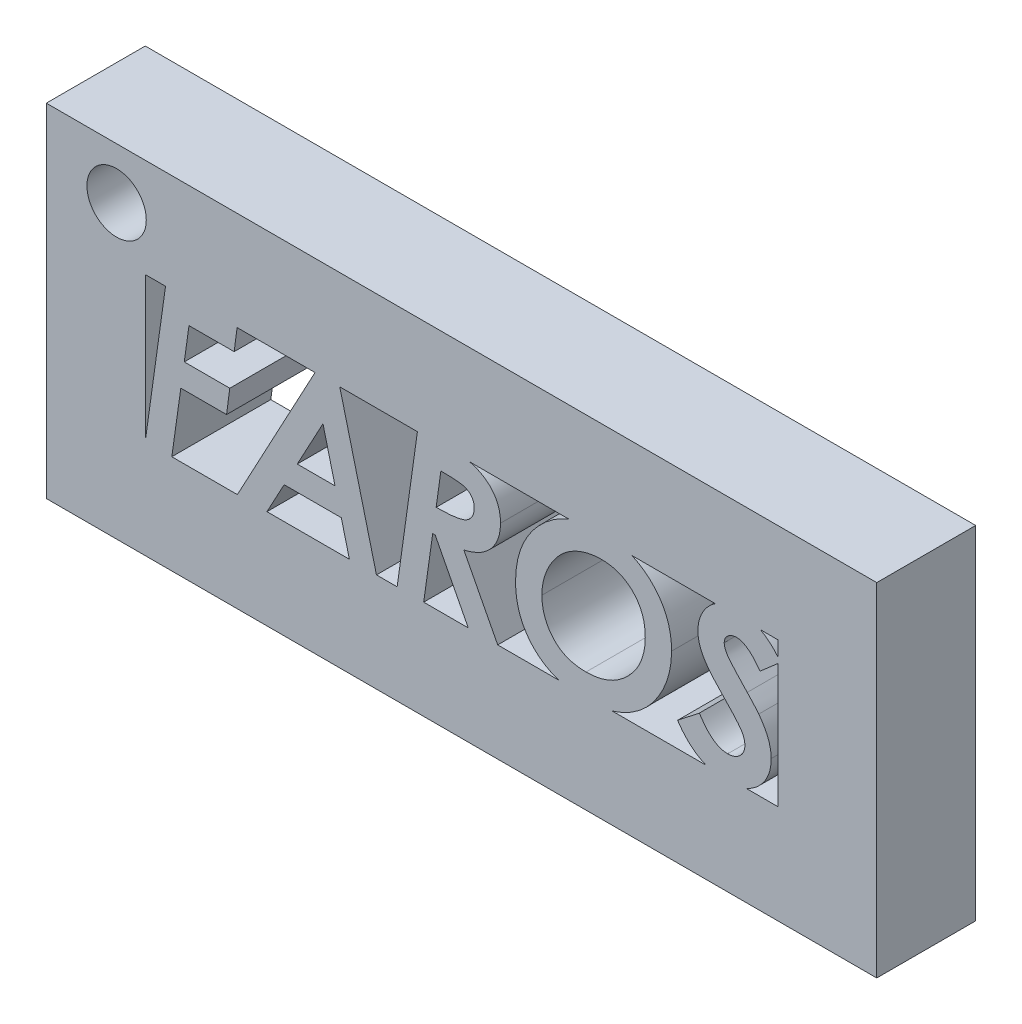
from build123d import *

# Parameters (mm, degrees)
BOSS_EXTRUDE4_DEPTH   = 5
BOSS_EXTRUDE4_2_DEPTH = 5
BOSS_EXTRUDE4_3_DEPTH = 5
BOSS_EXTRUDE4_4_DEPTH = 5
BOSS_EXTRUDE4_5_DEPTH = 5
SKETCH11_W            = 41.961124968
SKETCH11_H            = 17.302820452
SKETCH11_R            = 1.5
SKETCH11_W_2          = 31.961124968
SKETCH11_H_2          = 7.302820452
BOSS_EXTRUDE6_DEPTH   = 5


with BuildPart() as part:
    # Sketch9 → Boss-Extrude4 (new body)
    with BuildSketch(Plane.XY):
        Polygon((-20.86923015, 7.785590237), (-17.254105951, 7.785590237), (-17.415866435, 6.550868015), (-19.698321697, 6.550868015), (-19.937252319, 4.84125263), (-17.636988564, 4.84125263), (-17.800233088, 3.606530408), (-20.110885131, 3.606530408), (-20.566485759, 0.377256904), (-21.908058943, 0.377256904), align=None)
    extrude(amount=BOSS_EXTRUDE4_DEPTH)



with BuildPart() as body_2:
    # Sketch9 → Boss-Extrude4 2 (new body)
    with BuildSketch(Plane.XY):
        Polygon((-13.272423593, 7.785590237), (-12.105967263, 7.785590237), (-10.225687148, 0.377256904), (-11.592489031, 0.377256904), (-12.002084384, 1.991893656), (-14.891512469, 1.991893656), (-15.75819249, 0.377256904), (-17.254105951, 0.377256904), align=None)
        Polygon((-12.318185145, 3.226615878), (-12.92812605, 5.641150801), (-14.228146082, 3.226615878), align=None, mode=Mode.SUBTRACT)
    extrude(amount=BOSS_EXTRUDE4_2_DEPTH)


with BuildPart() as body_3:
    # Sketch9 → Boss-Extrude4 3 (new body)
    with BuildSketch(Plane.XY):
        with BuildLine():
            Line((-8.142093398, 7.785590237), (-6.855429736, 7.785590237))
            add(Edge.make_bspline(
                [(-6.855429736, 7.785590237), (-6.759945383, 7.785200034), (-6.57584007, 7.784447675), (-6.311090643, 7.773749139), (-6.068095708, 7.757608344), (-5.847144198, 7.736307368), (-5.648051641, 7.706753456), (-5.471232062, 7.671268064), (-5.315556075, 7.631750135), (-5.222197735, 7.595027498), (-5.178463256, 7.577824479)],
                knots=[0, 0, 0, 0, 1.348808202, 2.600664361, 3.742342956, 4.788858012, 5.735658768, 6.584006912, 7.336666444, 8, 8, 8, 8], degree=3))
            add(Edge.make_bspline(
                [(-5.178463256, 7.577824479), (-5.129223857, 7.555619862), (-5.032968625, 7.51221335), (-4.895040487, 7.438636648), (-4.765881521, 7.359374573), (-4.647632305, 7.271438682), (-4.537797417, 7.178531675), (-4.437057929, 7.079769881), (-4.346225006, 6.973637614), (-4.264345376, 6.862038495), (-4.191538364, 6.745116863), (-4.129041045, 6.622296145), (-4.075000695, 6.494616172), (-4.032799662, 6.360687563), (-3.99772553, 6.222117981), (-3.975040853, 6.078033146), (-3.959076448, 5.928919081), (-3.957764663, 5.827690121), (-3.957097404, 5.776198544)],
                knots=[0, 0, 0, 0, 1.116361014, 2.182309107, 3.229450697, 4.24598407, 5.225421932, 6.201651319, 7.158895679, 8.110002388, 9.060669178, 10.002827475, 10.956240434, 11.923213192, 12.902917952, 13.908279153, 14.936015885, 16, 16, 16, 16], degree=3))
            add(Edge.make_bspline(
                [(-3.957097404, 5.776198544), (-3.958666629, 5.712834614), (-3.961764532, 5.587743959), (-3.982006883, 5.403280959), (-4.019761382, 5.226269561), (-4.070605307, 5.056152162), (-4.133596846, 4.89182727), (-4.214832678, 4.736154263), (-4.308731198, 4.586420727), (-4.417174405, 4.444589767), (-4.538385799, 4.309360312), (-4.678342491, 4.18869077), (-4.82930188, 4.07446577), (-4.997465589, 3.974343595), (-5.178208702, 3.881339011), (-5.375653713, 3.802539874), (-5.586094888, 3.729820434), (-5.733652403, 3.693425367), (-5.809180738, 3.6747963)],
                knots=[0, 0, 0, 0, 0.995453645, 1.965186658, 2.910129054, 3.83459069, 4.752398018, 5.669942118, 6.588407184, 7.525617038, 8.471772905, 9.435289717, 10.423772802, 11.441988612, 12.505459691, 13.613754905, 14.778583949, 16, 16, 16, 16], degree=3))
            Line((-5.809180738, 3.6747963), (-4.099565353, 0.377256904))
            Line((-4.099565353, 0.377256904), (-5.585090527, 0.377256904))
            Line((-5.585090527, 0.377256904), (-7.259088924, 3.606530408))
            Line((-7.259088924, 3.606530408), (-7.383748379, 3.606530408))
            Line((-7.383748379, 3.606530408), (-7.839349007, 0.377256904))
            Line((-7.839349007, 0.377256904), (-9.180922191, 0.377256904))
            Line((-9.180922191, 0.377256904), (-8.142093398, 7.785590237))
        make_face()
        with BuildLine():
            add(Edge.make_bspline(
                [(-7.210115567, 4.84125263), (-7.114628003, 4.842136593), (-6.931984317, 4.843827392), (-6.671138366, 4.855658687), (-6.436386488, 4.874141036), (-6.227990092, 4.901031325), (-6.045293125, 4.932376752), (-5.888652739, 4.971707461), (-5.75782267, 5.018451382), (-5.650742016, 5.073889149), (-5.563999228, 5.138977614), (-5.488919638, 5.208437395), (-5.426402367, 5.286189883), (-5.374820016, 5.370929829), (-5.335036249, 5.462832861), (-5.306346002, 5.562521613), (-5.290482937, 5.669331399), (-5.28804433, 5.743005114), (-5.286798259, 5.780650667)],
                knots=[0, 0, 0, 0, 1.89335902, 3.621519463, 5.176573087, 6.561132097, 7.786781855, 8.850229336, 9.759505088, 10.53614971, 11.230649399, 11.903761734, 12.55942339, 13.202041648, 13.865362736, 14.539046595, 15.253486819, 16, 16, 16, 16], degree=3))
            add(Edge.make_bspline(
                [(-5.286798259, 5.780650667), (-5.28841125, 5.823335288), (-5.291540231, 5.906137601), (-5.318604635, 6.025396827), (-5.364883846, 6.13358108), (-5.429922931, 6.229656365), (-5.511088351, 6.314369945), (-5.610105181, 6.384144645), (-5.725844551, 6.439057574), (-5.834257392, 6.475382946), (-5.936416233, 6.496207589), (-6.032016628, 6.510775539), (-6.145340755, 6.523969484), (-6.276524863, 6.534176062), (-6.425019241, 6.540900826), (-6.591220632, 6.547331402), (-6.775286157, 6.549642912), (-6.903908744, 6.550447286), (-6.971184944, 6.550868015)],
                knots=[0, 0, 0, 0, 0.975025327, 1.891415476, 2.778007847, 3.650053007, 4.529910843, 5.446300992, 6.402314795, 7.450247022, 8.051382379, 8.78400578, 9.660805258, 10.659230114, 11.791644133, 13.059173022, 14.461796856, 16, 16, 16, 16], degree=3))
            Line((-6.971184944, 6.550868015), (-7.210115567, 4.84125263))
        make_face(mode=Mode.SUBTRACT)
    extrude(amount=BOSS_EXTRUDE4_3_DEPTH)


with BuildPart() as body_4:
    # Sketch9 → Boss-Extrude4 4 (new body)
    with BuildSketch(Plane.XY):
        with BuildLine():
            add(Edge.make_bspline(
                [(1.164328544, 7.975547502), (1.289137423, 7.972928124), (1.534195946, 7.967785052), (1.893399412, 7.920456336), (2.236086693, 7.844172228), (2.561422845, 7.73478263), (2.870657002, 7.596588136), (3.163045058, 7.426281055), (3.438267747, 7.2250634), (3.694084117, 6.995661608), (3.925805048, 6.742902044), (4.131292748, 6.472370429), (4.301948058, 6.182836228), (4.442487382, 5.877523491), (4.553273793, 5.556098385), (4.62884606, 5.217016292), (4.678729756, 4.862523994), (4.683519131, 4.6203061), (4.685958151, 4.496955088)],
                knots=[0, 0, 0, 0, 1.079937363, 2.120424901, 3.130164457, 4.114608815, 5.086352068, 6.057283592, 7.037967613, 8.032612779, 9.026667848, 10.002130715, 10.967845321, 11.92966918, 12.907375778, 13.904589319, 14.932898699, 16, 16, 16, 16], degree=3))
            add(Edge.make_bspline(
                [(4.685958151, 4.496955088), (4.684396117, 4.400915112), (4.681289353, 4.209899044), (4.651727024, 3.925877474), (4.60567291, 3.645886605), (4.542613873, 3.369845626), (4.458203089, 3.098639888), (4.357443621, 2.830662525), (4.237241357, 2.567009941), (4.099195532, 2.309724279), (3.947969492, 2.061836158), (3.782216498, 1.827439557), (3.604147296, 1.607925582), (3.414445297, 1.402430022), (3.211062096, 1.213703927), (2.997972902, 1.037793636), (2.770561515, 0.878697633), (2.53243809, 0.733376538), (2.283104951, 0.604224811), (2.024246901, 0.492597921), (1.756200842, 0.399267644), (1.479599685, 0.322107888), (1.193760237, 0.260722722), (0.898735422, 0.218317852), (0.594421748, 0.192582781), (0.388720491, 0.189078604), (0.284292152, 0.187299639)],
                knots=[0, 0, 0, 0, 1.005311864, 1.999487392, 2.986390894, 3.975195422, 4.961487101, 5.958115224, 6.97104375, 7.992937587, 9.013623077, 10.009524137, 10.996414046, 11.971324635, 12.935123389, 13.899409138, 14.862205298, 15.838449601, 16.81836937, 17.799766407, 18.787539403, 19.787875373, 20.804768927, 21.846385261, 22.906674593, 24, 24, 24, 24], degree=3))
            add(Edge.make_bspline(
                [(0.284292152, 0.187299639), (0.155038898, 0.189963296), (-0.097343069, 0.195164395), (-0.465172518, 0.241100304), (-0.81319342, 0.312822105), (-1.141421816, 0.415497243), (-1.450469163, 0.54789515), (-1.739315597, 0.7103525), (-2.008668367, 0.901098032), (-2.254012121, 1.121483776), (-2.477104622, 1.36322626), (-2.668676222, 1.628335581), (-2.834109593, 1.909654525), (-2.965357387, 2.21179268), (-3.070378896, 2.53104239), (-3.143548889, 2.869240137), (-3.189306382, 3.225853751), (-3.194574035, 3.469855567), (-3.197268345, 3.594658079)],
                knots=[0, 0, 0, 0, 1.129126937, 2.20475128, 3.23403939, 4.230775744, 5.204839333, 6.16680792, 7.121629951, 8.083044708, 9.04383724, 9.990659777, 10.936010704, 11.890255174, 12.863608629, 13.868449271, 14.909750384, 16, 16, 16, 16], degree=3))
            add(Edge.make_bspline(
                [(-3.197268345, 3.594658079), (-3.194031323, 3.737313213), (-3.187657455, 4.018208799), (-3.13162763, 4.431683963), (-3.04598454, 4.830799336), (-2.919793505, 5.213434248), (-2.760649078, 5.581040645), (-2.564634339, 5.932394589), (-2.334786431, 6.270345163), (-2.155590519, 6.478315786), (-2.064944961, 6.58351692)],
                knots=[0, 0, 0, 0, 1.045740506, 2.05911896, 3.05467723, 4.035585325, 5.008815224, 5.988058098, 6.982266978, 8, 8, 8, 8], degree=3))
            add(Edge.make_bspline(
                [(-2.064944961, 6.58351692), (-2.012177384, 6.640556236), (-1.907592299, 6.753607889), (-1.740210358, 6.910713554), (-1.568731027, 7.057802665), (-1.390727054, 7.193129089), (-1.208886825, 7.319835891), (-1.020312713, 7.433929579), (-0.825718047, 7.536648209), (-0.627219232, 7.630314229), (-0.421400865, 7.710290727), (-0.211820622, 7.781949717), (0.004429973, 7.841075074), (0.225826817, 7.890011918), (0.452581844, 7.928923137), (0.68499632, 7.955037486), (0.92267485, 7.971937016), (1.083171937, 7.974334962), (1.164328544, 7.975547502)],
                knots=[0, 0, 0, 0, 1.027812829, 2.037120149, 3.035266778, 4.015768311, 4.994345575, 5.966422343, 6.929711672, 7.904780536, 8.86860337, 9.849672715, 10.834163809, 11.833018336, 12.848777673, 13.876590502, 14.926281379, 16, 16, 16, 16], degree=3))
        make_face()
        with BuildLine():
            add(Edge.make_bspline(
                [(1.13316368, 6.74082528), (1.065838838, 6.739818786), (0.931896595, 6.737816374), (0.73364638, 6.717679172), (0.539384468, 6.686478282), (0.349927087, 6.643719262), (0.164365269, 6.588534114), (-0.01603762, 6.520335761), (-0.19261447, 6.43962566), (-0.363418543, 6.346494741), (-0.529022823, 6.242640819), (-0.685969253, 6.126738167), (-0.835361455, 6.000445974), (-0.974684896, 5.861537622), (-1.106999036, 5.712867311), (-1.231933486, 5.554134756), (-1.347927855, 5.383793961), (-1.455498064, 5.204678358), (-1.550986141, 5.01825694), (-1.635800788, 4.83026519), (-1.70798355, 4.640676346), (-1.765228765, 4.448974924), (-1.811959931, 4.255929416), (-1.844363705, 4.061031201), (-1.864483201, 3.864688429), (-1.866538307, 3.733216399), (-1.86756749, 3.667376095)],
                knots=[0, 0, 0, 0, 1.015557909, 2.02044445, 3.003357477, 3.982977463, 4.948851735, 5.922052592, 6.890662853, 7.875953625, 8.855459861, 9.837777552, 10.817397539, 11.804383193, 12.803598646, 13.818964529, 14.849984807, 15.911175445, 16.969421976, 18.008462528, 19.021851172, 20.027762868, 21.025304218, 22.016795393, 23.006824523, 24, 24, 24, 24], degree=3))
            add(Edge.make_bspline(
                [(-1.86756749, 3.667376095), (-1.865942692, 3.590613831), (-1.862745812, 3.439579871), (-1.834888749, 3.21724864), (-1.791726938, 3.003197111), (-1.726413745, 2.799199326), (-1.647052395, 2.603049623), (-1.546290645, 2.417679601), (-1.430459887, 2.239423892), (-1.295835664, 2.072810422), (-1.14546797, 1.918981501), (-0.975827151, 1.786266922), (-0.791229661, 1.672944778), (-0.590882677, 1.580730629), (-0.374951273, 1.508757677), (-0.142880173, 1.459850547), (0.104309454, 1.427441803), (0.274290303, 1.423859162), (0.361462291, 1.422021861)],
                knots=[0, 0, 0, 0, 1.032572517, 2.031642993, 3.01079972, 3.966643664, 4.909863955, 5.853952978, 6.801111379, 7.766917104, 8.731873648, 9.689385086, 10.65752794, 11.640388645, 12.650815691, 13.713650281, 14.827481725, 16, 16, 16, 16], degree=3))
            add(Edge.make_bspline(
                [(0.361462291, 1.422021861), (0.463504789, 1.424432841), (0.664998439, 1.429193573), (0.960957282, 1.471595951), (1.245064266, 1.541985565), (1.51734378, 1.638173858), (1.77788354, 1.762670549), (2.026690007, 1.914616175), (2.263121204, 2.095460207), (2.485275208, 2.300472366), (2.689350241, 2.524237418), (2.867739342, 2.76338308), (3.019234351, 3.014760828), (3.142661979, 3.277820969), (3.23816216, 3.553006289), (3.306240808, 3.8398333), (3.349202441, 4.138494689), (3.353885729, 4.341973934), (3.356257296, 4.445013648)],
                knots=[0, 0, 0, 0, 1.03369803, 2.041145535, 3.022357397, 3.995919545, 4.96236968, 5.943376615, 6.945032455, 7.973917545, 9.003120129, 10.009769043, 10.992465341, 11.972511115, 12.949140339, 13.93890809, 14.956285095, 16, 16, 16, 16], degree=3))
            add(Edge.make_bspline(
                [(3.356257296, 4.445013648), (3.354889143, 4.529702057), (3.35220787, 4.695672227), (3.321248969, 4.937351601), (3.274221312, 5.166421992), (3.208112898, 5.382812597), (3.119069922, 5.585306028), (3.01460703, 5.776394955), (2.888094431, 5.952837502), (2.744727794, 6.115217029), (2.586223925, 6.26276231), (2.413334183, 6.38997706), (2.229818034, 6.50042988), (2.03253681, 6.586600126), (1.825060289, 6.658072862), (1.604942995, 6.706124377), (1.37284039, 6.734501197), (1.214373409, 6.738682489), (1.13316368, 6.74082528)],
                knots=[0, 0, 0, 0, 1.12845219, 2.211511647, 3.242392028, 4.243671568, 5.221368115, 6.186708094, 7.141970352, 8.109200861, 9.070590294, 10.022934043, 10.966237583, 11.91979086, 12.887493425, 13.887534174, 14.917422563, 16, 16, 16, 16], degree=3))
        make_face(mode=Mode.SUBTRACT)
    extrude(amount=BOSS_EXTRUDE4_4_DEPTH)


with BuildPart() as body_5:
    # Sketch9 → Boss-Extrude4 5 (new body)
    with BuildSketch(Plane.XY):
        with BuildLine():
            Line((10.190266711, 6.755665691), (9.160342166, 5.857820806))
            add(Edge.make_bspline(
                [(9.160342166, 5.857820806), (9.10886898, 5.927353142), (9.010221569, 6.060610583), (8.853688369, 6.239344718), (8.703723817, 6.394662529), (8.552666221, 6.51852181), (8.405428074, 6.616735051), (8.260726311, 6.687878711), (8.117747551, 6.732835923), (8.022374819, 6.738214378), (7.976077342, 6.74082528)],
                knots=[0, 0, 0, 0, 1.358515141, 2.603569235, 3.730126198, 4.746094498, 5.666493297, 6.504166865, 7.273866877, 8, 8, 8, 8], degree=3))
            add(Edge.make_bspline(
                [(7.976077342, 6.74082528), (7.932345421, 6.738931994), (7.848243108, 6.735290953), (7.727519832, 6.704248799), (7.617798142, 6.654315581), (7.523597677, 6.582081026), (7.444921562, 6.49879757), (7.38650348, 6.405337995), (7.352481546, 6.302324946), (7.347765615, 6.231055215), (7.345359861, 6.194698143)],
                knots=[0, 0, 0, 0, 1.130304997, 2.173727141, 3.204821236, 4.229135679, 5.225705988, 6.15679035, 7.05971714, 8, 8, 8, 8], degree=3))
            add(Edge.make_bspline(
                [(7.345359861, 6.194698143), (7.347550834, 6.158881309), (7.352159112, 6.083547696), (7.385921778, 5.969343082), (7.436992277, 5.84901108), (7.498419152, 5.744382249), (7.567388301, 5.649376007), (7.639663648, 5.556413112), (7.734036066, 5.445264542), (7.848871364, 5.314657738), (7.983072466, 5.163490716), (8.140120111, 4.993962978), (8.317186592, 4.804961139), (8.442953315, 4.67296481), (8.508848108, 4.603806049)],
                knots=[0, 0, 0, 0, 0.642317819, 1.35098826, 2.122816345, 2.986294386, 3.520967692, 4.229638134, 5.099348126, 6.137609051, 7.351336444, 8.727500291, 10.285391505, 12, 12, 12, 12], degree=3))
            add(Edge.make_bspline(
                [(8.508848108, 4.603806049), (8.544594346, 4.566828341), (8.613184429, 4.495875305), (8.709425404, 4.392250718), (8.795322452, 4.296210403), (8.874630288, 4.211118036), (8.942522873, 4.132580025), (9.00049033, 4.062480614), (9.049701201, 4.001806202), (9.078795183, 3.963748678), (9.092076273, 3.946375827)],
                knots=[0, 0, 0, 0, 1.403722598, 2.693470914, 3.859630393, 4.920438112, 5.867965235, 6.69256451, 7.40316977, 8, 8, 8, 8], degree=3))
            add(Edge.make_bspline(
                [(9.092076273, 3.946375827), (9.144962392, 3.873313009), (9.246963949, 3.732396611), (9.379267544, 3.518143678), (9.488697384, 3.31171508), (9.574687207, 3.110667757), (9.639013279, 2.912802742), (9.685602735, 2.714849324), (9.714950392, 2.515160932), (9.718205364, 2.38080986), (9.719825672, 2.313930582)],
                knots=[0, 0, 0, 0, 1.215130546, 2.343624586, 3.390252636, 4.360992906, 5.286454858, 6.190345157, 7.099163061, 8, 8, 8, 8], degree=3))
            add(Edge.make_bspline(
                [(9.719825672, 2.313930582), (9.717809386, 2.240114645), (9.713841325, 2.094844513), (9.683093721, 1.881705929), (9.635201955, 1.677340205), (9.563788066, 1.482975136), (9.475609348, 1.29649569), (9.363691813, 1.120632546), (9.234945085, 0.952410109), (9.086314378, 0.795802563), (8.923635684, 0.652585678), (8.746496573, 0.528564629), (8.559260685, 0.422853126), (8.360024664, 0.335824157), (8.149395638, 0.269631491), (7.927749357, 0.222550819), (7.695494986, 0.191298838), (7.536411671, 0.188651467), (7.455178904, 0.187299639)],
                knots=[0, 0, 0, 0, 1.018989505, 2.005376454, 2.968035412, 3.912365187, 4.859556873, 5.811049809, 6.78527381, 7.780773345, 8.787785161, 9.773320145, 10.761314359, 11.752515283, 12.770107012, 13.804505292, 14.878913802, 16, 16, 16, 16], degree=3))
            add(Edge.make_bspline(
                [(7.455178904, 0.187299639), (7.392816236, 0.188549198), (7.269363537, 0.191022817), (7.086384041, 0.207446407), (6.907841144, 0.235483612), (6.733997222, 0.27594338), (6.564489287, 0.32646315), (6.399053071, 0.387103469), (6.238102521, 0.460501509), (6.081431513, 0.544748696), (5.929025565, 0.640174522), (5.78179917, 0.747917227), (5.638163852, 0.865899096), (5.500002208, 0.996354608), (5.364397162, 1.135682738), (5.233723815, 1.287053042), (5.109295202, 1.451099951), (5.030307764, 1.565660919), (4.990186583, 1.623851455)],
                knots=[0, 0, 0, 0, 1.003438088, 1.986398949, 2.953471805, 3.909242729, 4.856156023, 5.798037682, 6.742035895, 7.700024963, 8.658509928, 9.632892881, 10.633707184, 11.647385023, 12.688779161, 13.761077638, 14.862753205, 16, 16, 16, 16], degree=3))
            Line((4.990186583, 1.623851455), (6.08689298, 2.486079353))
            add(Edge.make_bspline(
                [(6.08689298, 2.486079353), (6.1415183, 2.402085903), (6.246286191, 2.240991805), (6.417053019, 2.023543319), (6.591149088, 1.83873636), (6.769206536, 1.687289484), (6.951798208, 1.56945216), (7.137613404, 1.485221095), (7.327479097, 1.431043804), (7.456315736, 1.425021156), (7.520476714, 1.422021861)],
                knots=[0, 0, 0, 0, 1.289844872, 2.473840458, 3.555310637, 4.554525788, 5.477014656, 6.343795492, 7.175205895, 8, 8, 8, 8], degree=3))
            add(Edge.make_bspline(
                [(7.520476714, 1.422021861), (7.579676276, 1.4246163), (7.694919425, 1.429666866), (7.859774212, 1.476691121), (8.011022229, 1.549182055), (8.141963571, 1.652687722), (8.252272477, 1.774248215), (8.332457199, 1.912731645), (8.380730365, 2.064464221), (8.386946304, 2.169628462), (8.390124818, 2.223404073)],
                knots=[0, 0, 0, 0, 1.07813582, 2.098795369, 3.104167493, 4.120866408, 5.124778177, 6.083335831, 7.019916046, 8, 8, 8, 8], degree=3))
            add(Edge.make_bspline(
                [(8.390124818, 2.223404073), (8.388606364, 2.267112905), (8.385517549, 2.356024729), (8.353319595, 2.488449152), (8.305532506, 2.622726918), (8.247613151, 2.736211923), (8.185143371, 2.835723343), (8.118987258, 2.925837982), (8.0357439, 3.031611487), (7.932760164, 3.15056116), (7.814245726, 3.28670274), (7.675710064, 3.435251583), (7.521579464, 3.601123606), (7.410912338, 3.714612526), (7.352780066, 3.774227056)],
                knots=[0, 0, 0, 0, 0.82235112, 1.672813781, 2.554588539, 3.50524042, 4.06657461, 4.767804758, 5.610876414, 6.602916144, 7.732569792, 9.01260869, 10.430754915, 12, 12, 12, 12], degree=3))
            add(Edge.make_bspline(
                [(7.352780066, 3.774227056), (7.291252952, 3.837862439), (7.172311201, 3.96087981), (7.004040478, 4.140914914), (6.852468552, 4.308481832), (6.71776705, 4.463756887), (6.599824703, 4.607019199), (6.496600699, 4.737181951), (6.411219318, 4.855962181), (6.363064747, 4.933029629), (6.340664014, 4.968880168)],
                knots=[0, 0, 0, 0, 1.354401886, 2.618275412, 3.770529779, 4.811580489, 5.763301005, 6.60974666, 7.35327647, 8, 8, 8, 8], degree=3))
            add(Edge.make_bspline(
                [(6.340664014, 4.968880168), (6.290647445, 5.05821427), (6.193606668, 5.231537851), (6.093564821, 5.504332949), (6.028371475, 5.77362335), (6.019849086, 5.953436004), (6.015659006, 6.041841906)],
                knots=[0, 0, 0, 0, 1.081804801, 2.098888081, 3.065307629, 4, 4, 4, 4], degree=3))
            add(Edge.make_bspline(
                [(6.015659006, 6.041841906), (6.017163525, 6.098798552), (6.020156293, 6.212095959), (6.04170192, 6.379308027), (6.074691595, 6.542815839), (6.127282577, 6.700139264), (6.187935148, 6.855217689), (6.267215588, 7.003976271), (6.356287453, 7.150417095), (6.427747061, 7.241133798), (6.463839428, 7.286952417)],
                knots=[0, 0, 0, 0, 1.012167245, 2.013389743, 2.992947912, 3.971795425, 4.958040075, 5.949133471, 6.964161297, 8, 8, 8, 8], degree=3))
            add(Edge.make_bspline(
                [(6.463839428, 7.286952417), (6.511484478, 7.342172681), (6.605457689, 7.451086943), (6.768049182, 7.590310323), (6.940441376, 7.710567651), (7.126345105, 7.807110046), (7.323622635, 7.884055457), (7.53415022, 7.936268071), (7.756314408, 7.970378351), (7.908669305, 7.973800212), (7.98646563, 7.975547502)],
                knots=[0, 0, 0, 0, 1.010152455, 1.992384693, 2.959065588, 3.919519142, 4.890305168, 5.888624478, 6.921877408, 8, 8, 8, 8], degree=3))
            add(Edge.make_bspline(
                [(7.98646563, 7.975547502), (8.09404604, 7.971791711), (8.306264143, 7.964382863), (8.618468464, 7.906797795), (8.915980965, 7.809186185), (9.201777114, 7.676564968), (9.471216499, 7.50191049), (9.727897572, 7.290785417), (9.971678692, 7.041684898), (10.116046497, 6.85278175), (10.190266711, 6.755665691)],
                knots=[0, 0, 0, 0, 0.984438778, 1.941949542, 2.894274057, 3.844399604, 4.817935388, 5.825099055, 6.88187249, 8, 8, 8, 8], degree=3))
        make_face()
    extrude(amount=BOSS_EXTRUDE4_5_DEPTH)


with BuildPart() as part_1:
    add(part.part)

    add(body_2.part)  # Boss-Extrude6 merges body 2

    add(body_3.part)  # Boss-Extrude6 merges body 3

    add(body_4.part)  # Boss-Extrude6 merges body 4

    add(body_5.part)  # Boss-Extrude6 merges body 5
    # Sketch11 → Boss-Extrude6 (add)
    with BuildSketch(Plane.XY.offset(5)):
        with Locations((-5.927496459, 4.02866713)):
            Rectangle(SKETCH11_W, SKETCH11_H)
        with Locations((-23.356365571, 10.091468227)):
            Circle(SKETCH11_R, mode=Mode.SUBTRACT)
        with Locations((-5.927496459, 4.02866713)):
            Rectangle(SKETCH11_W_2, SKETCH11_H_2, mode=Mode.SUBTRACT)
    extrude(amount=-BOSS_EXTRUDE6_DEPTH)


solid = part_1.part
